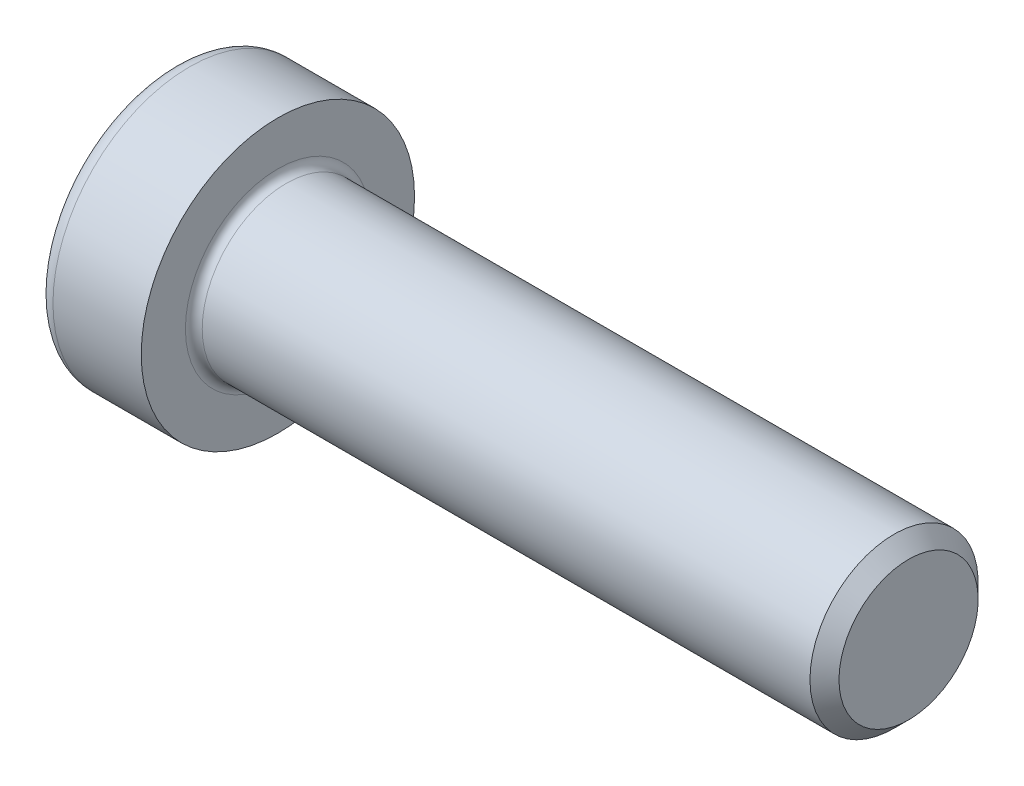
from build123d import *

# Parameters (mm, degrees)
FILLET1_R   = 0.4
FILLET2_R   = 0.8
HEX_2_DEPTH = 3.8


with BuildPart() as part:
    # BodySke → Base-Revolve (revolve)
    with BuildSketch(Plane.XY, mode=Mode.PRIVATE) as base_revolve_sk:
        Polygon((0, 0), (0, 6.5), (5, 6.5), (5, 4), (34.3095, 4), (35, 3.3095), (35, 0), align=None)
    revolve(base_revolve_sk.sketch.rotate(Axis((-31.75, 0, 0), (1, 0, 0)), 90), axis=Axis((-31.75, 0, 0), (1, 0, 0)))

    # Fillet1
    fillet1_edges = [part.edges().sort_by_distance(p)[0] for p in [
        (5, 0, -4),
    ]]
    fillet(fillet1_edges, radius=FILLET1_R)

    # Fillet2
    fillet2_edges = [part.edges().sort_by_distance(p)[0] for p in [
        (0, 0, -6.5),
    ]]
    fillet(fillet2_edges, radius=FILLET2_R)

    # Sketch2 → Hex-PreBroach (revolve, cut)
    with BuildSketch(Plane.XY, mode=Mode.PRIVATE) as hex_prebroach_sk:
        Polygon((0, 2.5), (3.8, 2.5), (5.243375673, 0), (0, 0), align=None)
    revolve(hex_prebroach_sk.sketch.rotate(Axis((0, 0, 0), (1, 0, 0)), 90), axis=Axis((0, 0, 0), (1, 0, 0)), mode=Mode.SUBTRACT)

    # Sketch3 → Hex 2 (cut)
    with BuildSketch(Plane(origin=(0, 0, 0), x_dir=(0, 0.500000000000001, 0.866025403784438), z_dir=(-1, 0, 0))):
        Polygon((1.443375673, 2.5), (-1.443375673, 2.5), (-2.886751346, 0), (-1.443375673, -2.5), (1.443375673, -2.5), (2.886751346, 0), align=None)
    extrude(amount=-HEX_2_DEPTH, mode=Mode.SUBTRACT)


solid = part.part
